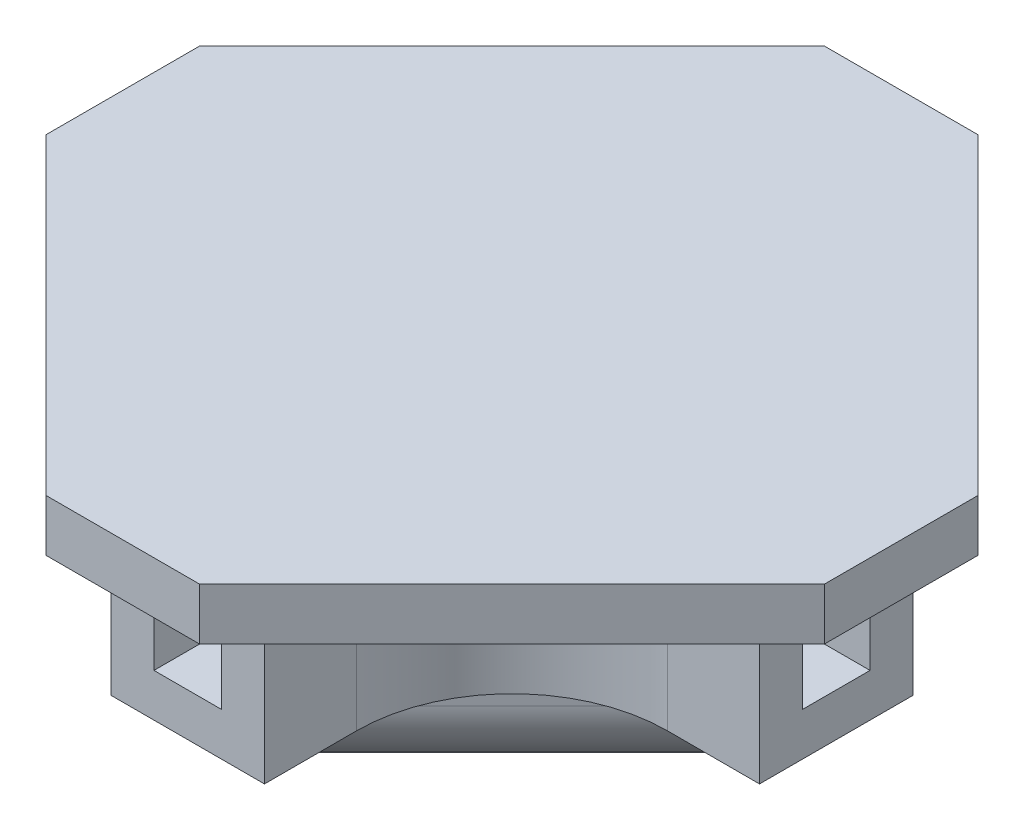
from build123d import *

# Parameters (mm, degrees)
BOSS_EXTRUDE1_DEPTH                  = 7.5184
SKETCH2_W                            = 3.302
SKETCH2_H                            = 3.302
CUT_EXTRUDE1_DEPTH                   = 12.7
CIRPATTERN1_COUNT                    = 4
BOSS_EXTRUDE2_DEPTH                  = 2.54
BOSS_EXTRUDE3_REACH                  = 29.97
BOSS_EXTRUDE3_END_RADIUS             = 7.62
SKETCH6_R                            = 2.2225
BOSS_EXTRUDE3_DIRECTION_2_REACH      = 29.97
BOSS_EXTRUDE3_DIRECTION_2_END_RADIUS = 7.62


with BuildPart() as part:
    # Sketch1 → Boss-Extrude1 (new body)
    with BuildSketch(Plane(origin=(0, 0, 0), x_dir=(1, 0, 0), z_dir=(0, 1, 0))):
        with BuildLine():
            Line((3.7592, 11.3792), (3.7592, 15.875))
            Line((3.7592, 15.875), (-3.7592, 15.875))
            Line((-3.7592, 15.875), (-3.7592, 11.3792))
            ThreePointArc((-3.7592, 11.3792), (-5.991046327, 5.991046327), (-11.3792, 3.7592))
            Line((-11.3792, 3.7592), (-15.875, 3.7592))
            Line((-15.875, 3.7592), (-15.875, -3.7592))
            Line((-15.875, -3.7592), (-11.3792, -3.7592))
            ThreePointArc((-11.3792, -3.7592), (-5.991046327, -5.991046327), (-3.7592, -11.3792))
            Line((-3.7592, -11.3792), (-3.7592, -15.875))
            Line((-3.7592, -15.875), (3.7592, -15.875))
            Line((3.7592, -15.875), (3.7592, -11.3792))
            ThreePointArc((3.7592, -11.3792), (5.991046327, -5.991046327), (11.3792, -3.7592))
            Line((11.3792, -3.7592), (15.875, -3.7592))
            Line((15.875, -3.7592), (15.875, 3.7592))
            Line((15.875, 3.7592), (11.3792, 3.7592))
            ThreePointArc((11.3792, 3.7592), (5.991046327, 5.991046327), (3.7592, 11.3792))
        make_face()
    extrude(amount=-BOSS_EXTRUDE1_DEPTH)

    # Sketch2 → Cut-Extrude1 (cut)
    with BuildSketch(Plane.XY.offset(15.875)):
        with Locations((0, -3.7592)):
            Rectangle(SKETCH2_W, SKETCH2_H)
    cut_extrude1 = extrude(amount=-CUT_EXTRUDE1_DEPTH, mode=Mode.SUBTRACT)

    # CirPattern1: Cut-Extrude1 ×4 about axis
    cirpattern1_axis = Axis((0, -22.390859054, 0), (0, 1, 0))
    for i in range(1, CIRPATTERN1_COUNT):
        add(cut_extrude1.rotate(cirpattern1_axis, i * 360 / CIRPATTERN1_COUNT), mode=Mode.SUBTRACT)

    # Sketch4 → Boss-Extrude2 (add)
    with BuildSketch(Plane(origin=(0, 0, 0), x_dir=(1, 0, 0), z_dir=(0, 1, 0))):
        Polygon((3.7592, 19.05), (19.05, 3.7592), (19.05, -3.7592), (3.7592, -19.05), (-3.7592, -19.05), (-19.05, -3.7592), (-19.05, 3.7592), (-3.7592, 19.05), align=None)
    extrude(amount=BOSS_EXTRUDE2_DEPTH)

    # Boss-Extrude3: up to this cylinder (the profile starts outside it)
    boss_extrude3_end = Plane(origin=(-11.3792, -9.4234, 11.3792), z_dir=(0, 1, 0)) * Cylinder(BOSS_EXTRUDE3_END_RADIUS, 76.18, mode=Mode.PRIVATE)
    # Sketch6 → Boss-Extrude3 (add, up to the surface)
    with BuildSketch(Plane(origin=(0, 0, 0), x_dir=(0.7071067811865474, 0, 0.7071067811865477), z_dir=(-0.7071067811865477, 0, 0.7071067811865474)), mode=Mode.PRIVATE) as boss_extrude3_sk1:
        with BuildLine():
            Line((-3.81, -11.3284), (-3.81, -7.5184))
            Line((-3.81, -7.5184), (3.81, -7.5184))
            Line((3.81, -7.5184), (3.81, -11.3284))
            ThreePointArc((3.81, -11.3284), (0, -15.1384), (-3.81, -11.3284))
        make_face()
        with Locations((0, -11.3284)):
            Circle(SKETCH6_R, mode=Mode.SUBTRACT)
    boss_extrude3_tool1 = extrude(boss_extrude3_sk1.sketch, amount=BOSS_EXTRUDE3_REACH, mode=Mode.PRIVATE) - boss_extrude3_end
    add(boss_extrude3_tool1.solids().sort_by_distance((-2.617877, -9.4234, -2.617877))[0])

    # Boss-Extrude3 direction 2: up to this cylinder (the profile starts outside it)
    boss_extrude3_direction_2_end = Plane(origin=(11.3792, -9.4234, -11.3792), z_dir=(0, 1, 0)) * Cylinder(BOSS_EXTRUDE3_DIRECTION_2_END_RADIUS, 76.18, mode=Mode.PRIVATE)
    # Sketch6 → Boss-Extrude3 direction 2 (add, up to the surface)
    with BuildSketch(Plane(origin=(0, 0, 0), x_dir=(0.7071067811865474, 0, 0.7071067811865477), z_dir=(-0.7071067811865477, 0, 0.7071067811865474)), mode=Mode.PRIVATE) as boss_extrude3_direction_2_sk1:
        with BuildLine():
            Line((-3.81, -11.3284), (-3.81, -7.5184))
            Line((-3.81, -7.5184), (3.81, -7.5184))
            Line((3.81, -7.5184), (3.81, -11.3284))
            ThreePointArc((3.81, -11.3284), (0, -15.1384), (-3.81, -11.3284))
        make_face()
        with Locations((0, -11.3284)):
            Circle(SKETCH6_R, mode=Mode.SUBTRACT)
    boss_extrude3_direction_2_tool1 = extrude(boss_extrude3_direction_2_sk1.sketch, amount=-BOSS_EXTRUDE3_DIRECTION_2_REACH, mode=Mode.PRIVATE) - boss_extrude3_direction_2_end
    add(boss_extrude3_direction_2_tool1.solids().sort_by_distance((-2.617877, -9.4234, -2.617877))[0])


solid = part.part
